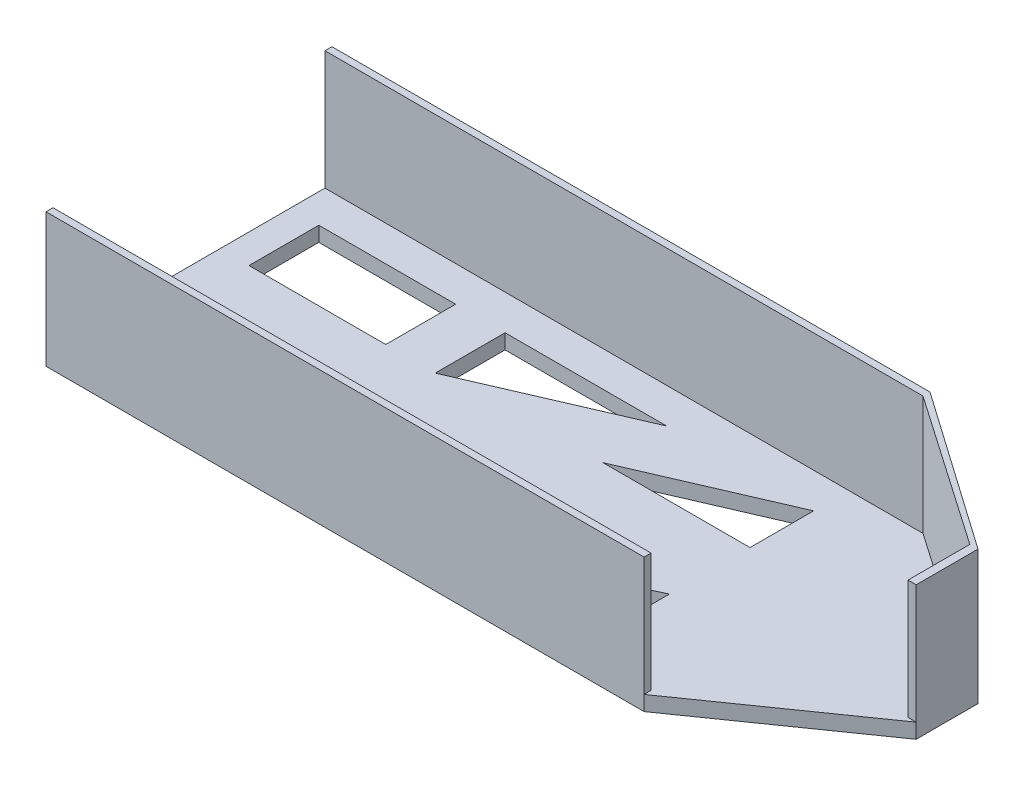
from build123d import *

# Parameters (mm, degrees)
SKETCH2_W           = 23.364084101
SKETCH2_H           = 11.930596137
BOSS_EXTRUDE1_DEPTH = 2.54
SKETCH3_W           = 102.155729419
SKETCH3_H           = 1.194871536
BOSS_EXTRUDE3_DEPTH = 20.32
SCALE1_SCALE        = 0.6


with BuildPart() as part:
    # Sketch2 → Boss-Extrude1 (new body)
    with BuildSketch(Plane(origin=(0, 0, 0), x_dir=(1, 0, 0), z_dir=(0, 1, 0))):
        Polygon((0, 48.840877934), (27.34094948, 29.702213298), (27.34094948, 19.138664636), (0, 0), (-102.155729419, 0), (-102.155729419, 48.840877934), align=None)
        Polygon((-97.184647696, 5.095358767), (-97.184647696, 17.025954903), (-73.820563595, 17.025954903), align=None, mode=Mode.SUBTRACT)
        with Locations((-85.502605646, 35.667511367)):
            Rectangle(SKETCH2_W, SKETCH2_H, mode=Mode.SUBTRACT)
        Polygon((-65.369724665, 41.632809435), (-65.369724665, 29.702213298), (-37.780221099, 41.632809435), align=None, mode=Mode.SUBTRACT)
        Polygon((-12.676258395, 30.777041779), (-12.676258395, 41.632809435), (-37.780221099, 30.777041779), align=None, mode=Mode.SUBTRACT)
        Polygon((-65.369724665, 17.025954903), (-65.369724665, 5.095358767), (-88.236700593, 5.095358767), align=None, mode=Mode.SUBTRACT)
        Polygon((-56.670331649, 17.025954903), (-56.670331649, 5.095358767), (-37.780221099, 17.025954903), align=None, mode=Mode.SUBTRACT)
        Polygon((-37.780221099, 5.095358767), (-12.676258395, 5.095358767), (-12.676258395, 17.025954903), align=None, mode=Mode.SUBTRACT)
    extrude(amount=BOSS_EXTRUDE1_DEPTH)

    # Sketch3 → Boss-Extrude3 (add)
    with BuildSketch(Plane(origin=(0, 2.54, 0), x_dir=(1, 0, 0), z_dir=(0, 1, 0))):
        Polygon((-102.155729419, 48.840877934), (0, 48.840877934), (27.34094948, 29.702213298), (27.34094948, 19.138664636), (25.946282646, 19.138664636), (25.946282646, 29.702213298), (0, 47.646006398), (-102.155729419, 47.646006398), align=None)
        with Locations((-51.07786471, 0.597435768)):
            Rectangle(SKETCH3_W, SKETCH3_H)
    extrude(amount=BOSS_EXTRUDE3_DEPTH)


with BuildPart() as part_1:
    # Scale1: scaled about (-39.022733584, 5.036168927, -24.995733367)
    add(part.part.scale(SCALE1_SCALE).moved(Location((-15.609093434, 2.014467571, -9.998293347))))


solid = part_1.part
